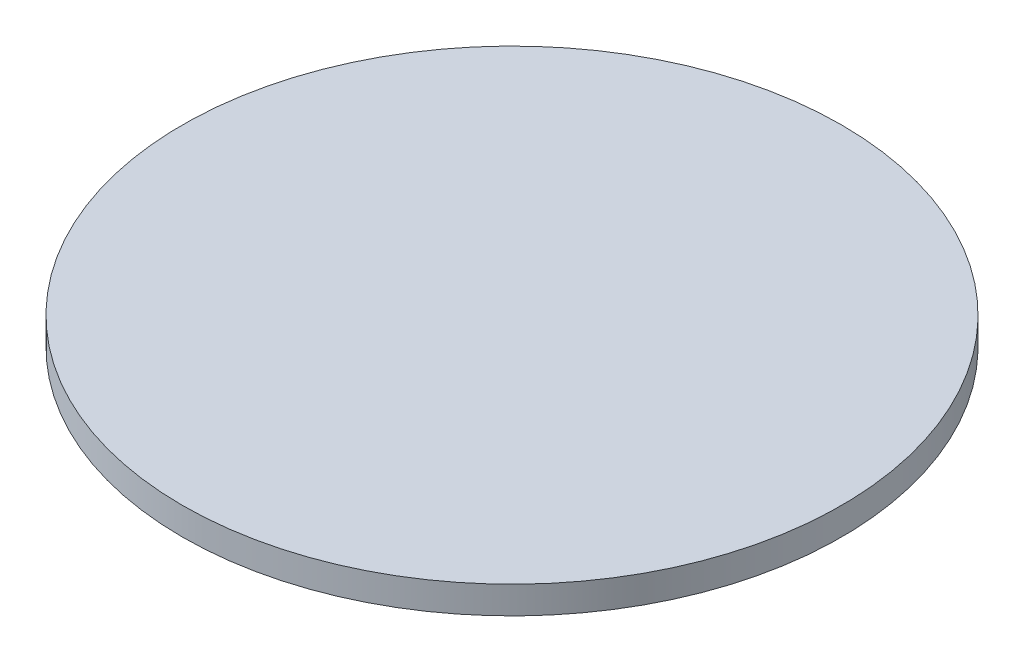
from build123d import *

# Parameters (mm, degrees)
SKETCH1_R           = 60
BOSS_EXTRUDE1_DEPTH = 5


with BuildPart() as part:
    # Sketch1 → Boss-Extrude1 (new body)
    with BuildSketch(Plane(origin=(0, 0, 0), x_dir=(1, 0, 0), z_dir=(0, 1, 0))):
        Circle(SKETCH1_R)
    extrude(amount=BOSS_EXTRUDE1_DEPTH)


solid = part.part
